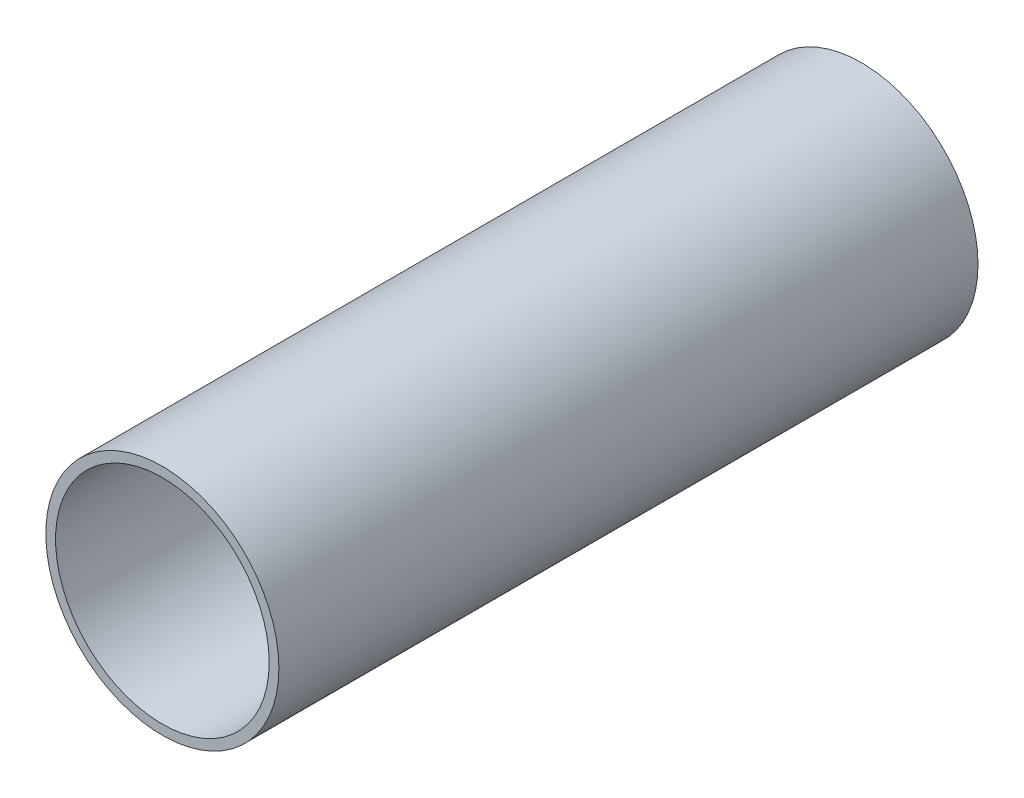
from build123d import *

# Parameters (mm, degrees)
SKETCH3_R           = 38.1
SKETCH3_R_2         = 34.925
BOSS_EXTRUDE2_DEPTH = 228.6
SKETCH5_R           = 6.35
CUT_EXTRUDE3_DEPTH  = 235.864173513


with BuildPart() as part:
    # Sketch3 → Boss-Extrude2 (new body)
    with BuildSketch(Plane.XY):
        Circle(SKETCH3_R)
        Circle(SKETCH3_R_2, mode=Mode.SUBTRACT)
    extrude(amount=BOSS_EXTRUDE2_DEPTH)

    # Sketch5 → Cut-Extrude3 (cut, through all)
    with BuildSketch(Plane(origin=(0, 0, 0), x_dir=(1, 0, 0), z_dir=(0, 1, 0))):
        with Locations(Location((-3.108447312, -79.168272232, 0), (0, 0, 270))):
            Circle(SKETCH5_R)
        with Locations(Location((-3.108447312, -155.368272232, 0), (0, 0, 270))):
            Circle(SKETCH5_R)
    extrude(amount=-CUT_EXTRUDE3_DEPTH, mode=Mode.SUBTRACT)


solid = part.part
